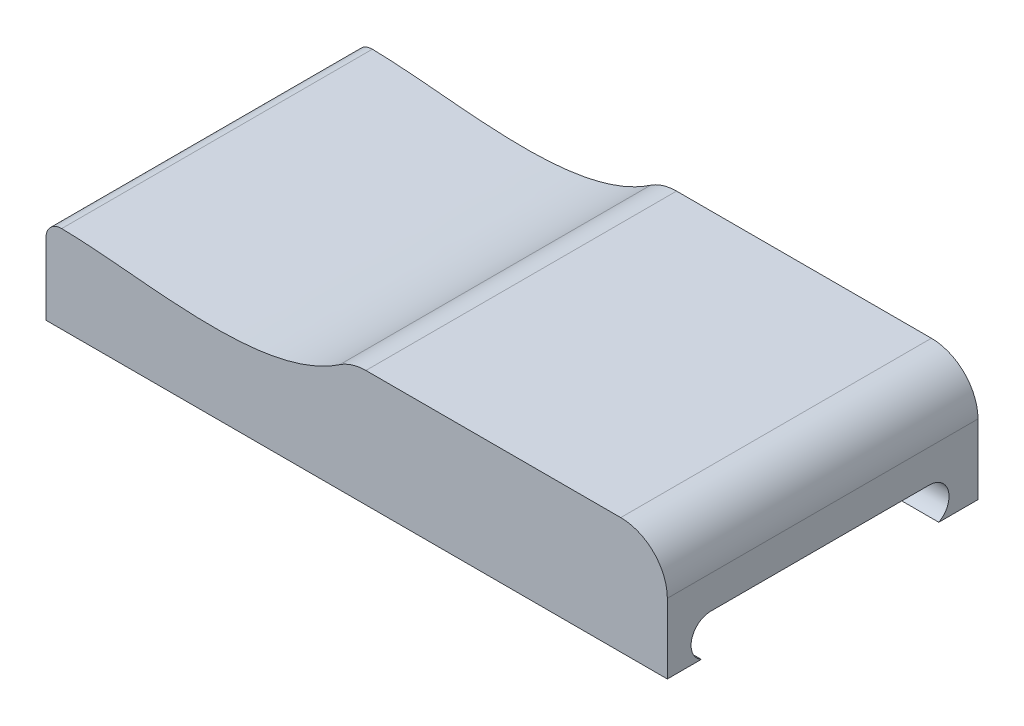
from build123d import *

# Parameters (mm, degrees)
SKETCH1_W           = 400
SKETCH1_H           = 200
BOSS_EXTRUDE1_DEPTH = 60
CUT_EXTRUDE1_DEPTH  = 220
FILLET1_R           = 30
FILLET2_R           = 10
SKETCH9_W           = 400
SKETCH9_H           = 200
BOSS_EXTRUDE4_DEPTH = 15
CUT_EXTRUDE9_DEPTH  = 417.653333254


with BuildPart() as part:
    # Sketch1 → Boss-Extrude1 (new body)
    with BuildSketch(Plane(origin=(0, 0, 0), x_dir=(1, 0, 0), z_dir=(0, 1, 0))):
        Rectangle(SKETCH1_W, SKETCH1_H)
    extrude(amount=BOSS_EXTRUDE1_DEPTH)

    # Sketch3 → Cut-Extrude1 (cut)
    with BuildSketch(Plane.XY.offset(100)):
        with BuildLine():
            Line((-200, 41.033284164), (-200, 60))
            Line((-200, 60), (-3.947040737, 60))
            add(Edge.make_bspline(
                [(-200, 41.033284164), (-145.162329498, 43.56543882), (-56.826978114, 16.661467413), (-3.947040737, 60)],
                knots=[0, 0, 0, 0, 1, 1, 1, 1], degree=3))
        make_face()
    extrude(amount=-CUT_EXTRUDE1_DEPTH, mode=Mode.SUBTRACT)

    # Fillet1
    fillet1_edges = [part.edges().sort_by_distance(p)[0] for p in [
        (-3.947040737, 60, 0),
        (200, 60, 0),
    ]]
    fillet(fillet1_edges, radius=FILLET1_R)

    # Fillet2
    fillet2_edges = [part.edges().sort_by_distance(p)[0] for p in [
        (-200, 41.033284164, 0),
    ]]
    fillet(fillet2_edges, radius=FILLET2_R)

    # Sketch9 → Boss-Extrude4 (add)
    with BuildSketch(Plane.XZ):
        Rectangle(SKETCH9_W, SKETCH9_H)
    extrude(amount=BOSS_EXTRUDE4_DEPTH)

    # Sketch10 → Cut-Extrude9 (cut, through all)
    with BuildSketch(Plane.ZY.offset(200)):
        with BuildLine():
            Line((-74.762482239, -15), (1.674345002, -15))
            Line((1.674345002, -15), (1.674345002, 8.829888791))
            Line((1.674345002, 8.829888791), (-68.645654998, 8.829888791))
            ThreePointArc((-68.645654998, 8.829888791), (-80.94686607, -0.71254788), (-74.762482239, -15))
        make_face()
        with BuildLine():
            Line((1.674345002, 8.829888791), (1.674345002, -15))
            Line((1.674345002, -15), (78.111172243, -15))
            ThreePointArc((78.111172243, -15), (84.295556073, -0.71254788), (71.994345002, 8.829888791))
            Line((71.994345002, 8.829888791), (1.674345002, 8.829888791))
        make_face()
    extrude(amount=-CUT_EXTRUDE9_DEPTH, mode=Mode.SUBTRACT)


solid = part.part
